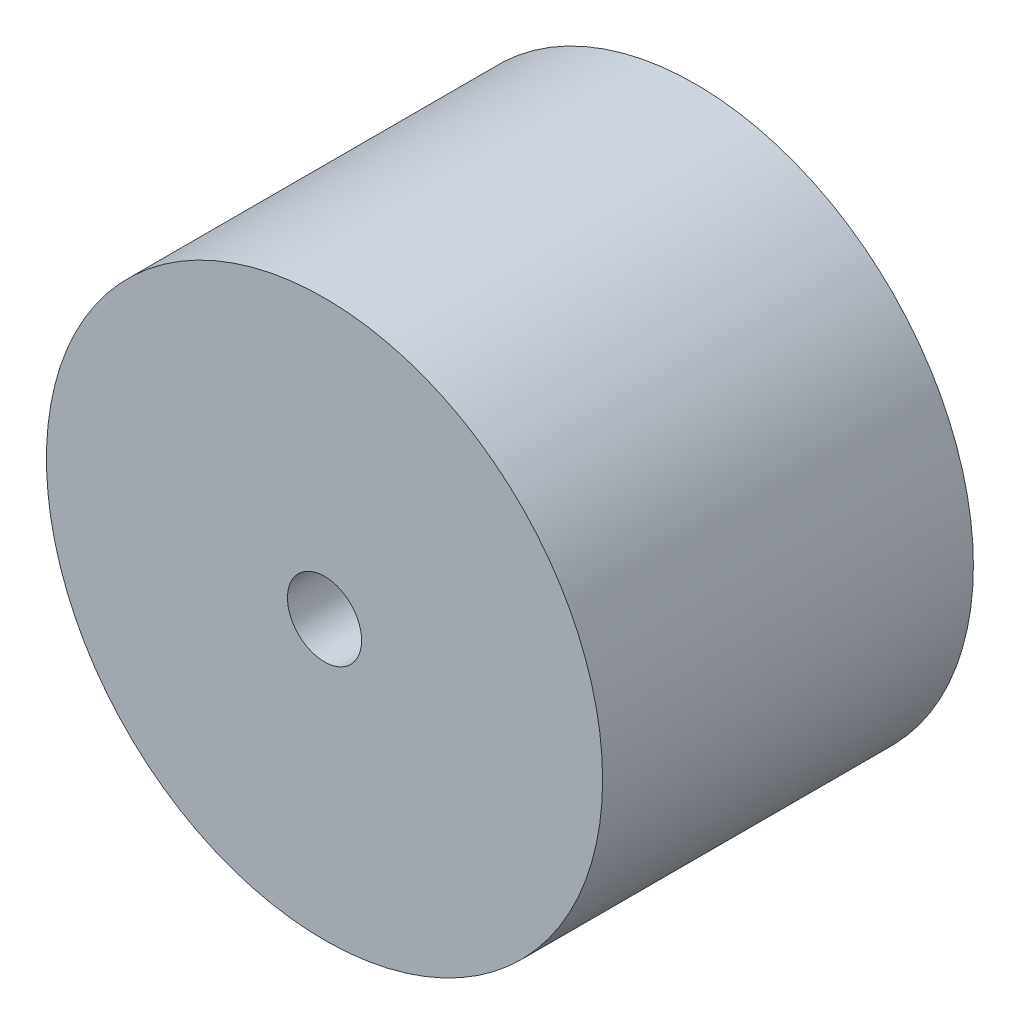
from build123d import *

# Parameters (mm, degrees)
SKETCH1_R           = 30
SKETCH1_R_2         = 4
BOSS_EXTRUDE1_DEPTH = 40


with BuildPart() as part:
    # Sketch1 → Boss-Extrude1 (new body)
    with BuildSketch(Plane.XY):
        Circle(SKETCH1_R)
        Circle(SKETCH1_R_2, mode=Mode.SUBTRACT)
    extrude(amount=BOSS_EXTRUDE1_DEPTH)


solid = part.part
